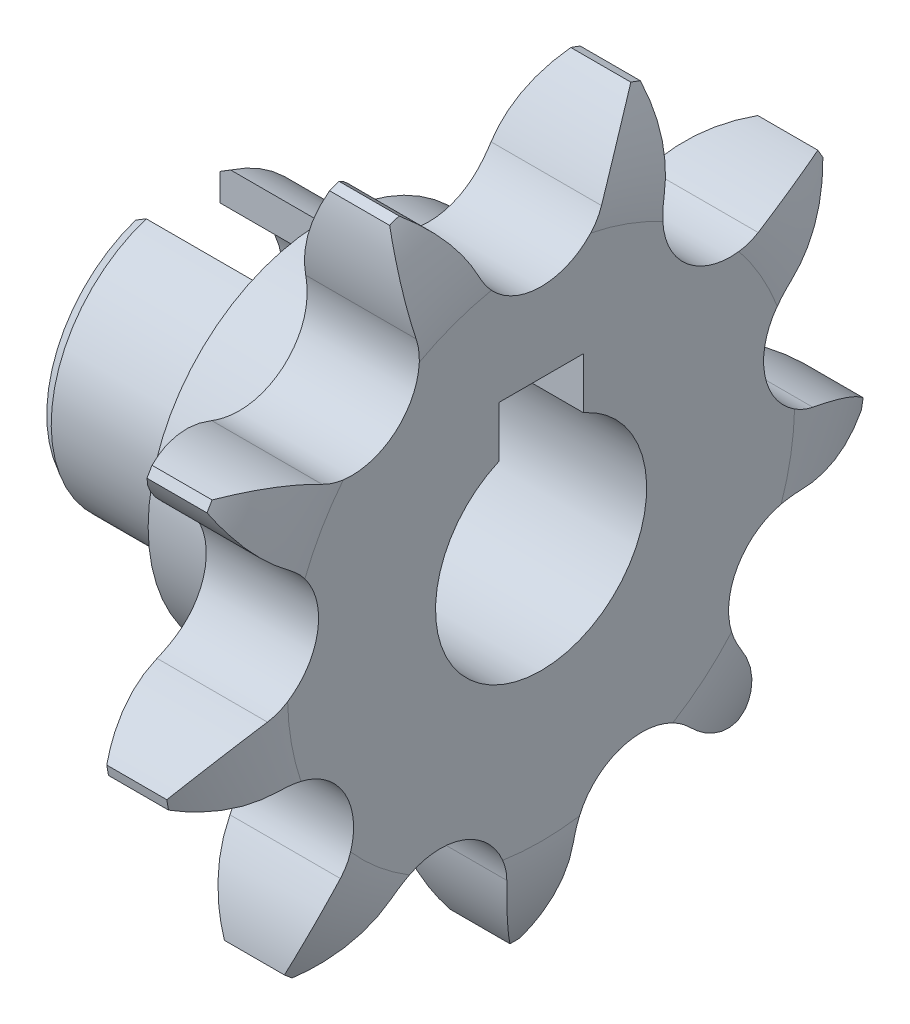
from build123d import *

# Parameters (mm, degrees)
TOOTHCUT_DEPTH     = 25.212835916
TEETHCUTS_COUNT    = 9
TEETHCUTS_ANGLE    = 320
HUBNEAONESKE_R     = 8.409661226
HUBNEARONE_DEPTH   = 16.6809
HUBNEARONEFILLET_R = 0.4
BORSKE_R           = 5
BORE_DEPTH         = 22.0005
SKETCH2_R          = 10
CUT_EXTRUDE2_DEPTH = 4.8
SKETCH1_OUTSIDE_W  = 44.854
SKETCH1_OUTSIDE_H  = 44.354
SKETCH1_OUTSIDE_R  = 6.5
CUT_EXTRUDE1_DEPTH = 7
CHAMFER1_SIZE      = 0.5
CHAMFER1_SIZE2     = 0.288675135
SKETCH3_W          = 4
SKETCH3_H          = 4
CUT_EXTRUDE3_DEPTH = 30.098364443


with BuildPart() as part:
    # BasProSke → Base-Revolve (revolve)
    with BuildSketch(Plane(origin=(0, 0, 0), x_dir=(1, 0, 0), z_dir=(0, 1, 0)), mode=Mode.PRIVATE) as base_revolve_sk:
        with BuildLine():
            Line((0, 0), (0, 12.006866982))
            ThreePointArc((0, 12.006866982), (0.314698702, 14.435029868), (1.238, 16.702743471))
            Line((1.238, 16.702743471), (4.0816, 16.702743471))
            ThreePointArc((4.0816, 16.702743471), (5.004901298, 14.435029868), (5.3196, 12.006866982))
            Line((5.3196, 12.006866982), (5.3196, 0))
            Line((5.3196, 0), (0, 0))
        make_face()
    revolve(base_revolve_sk.sketch.rotate(Axis((-10, 0, 0), (1, 0, 0)), 180), axis=Axis((-10, 0, 0), (1, 0, 0)))

    # TooCutSke → ToothCut (cut, through all)
    with BuildSketch(Plane(origin=(0, 0, 0), x_dir=(0, 0, -1), z_dir=(1, 0, 0))):
        with BuildLine():
            ThreePointArc((2.906302496, 12.60113736), (4.198990076, 14.583034398), (5.994051414, 16.124693193))
            ThreePointArc((5.994051414, 16.124693193), (0, 17.202743471), (-5.994051414, 16.124693193))
            ThreePointArc((-5.994051414, 16.124693193), (-4.198990076, 14.583034398), (-2.906302496, 12.60113736))
            ThreePointArc((-2.906302496, 12.60113736), (0, 10.749618471), (2.906302496, 12.60113736))
        make_face()
    toothcut = extrude(amount=TOOTHCUT_DEPTH, mode=Mode.SUBTRACT)

    # TeethCuts: ToothCut ×9 about axis
    teethcuts_axis = Axis((-10, 0, 0), (1, 0, 0))
    for i in range(1, TEETHCUTS_COUNT):
        add(toothcut.rotate(teethcuts_axis, i * TEETHCUTS_ANGLE / (TEETHCUTS_COUNT - 1)), mode=Mode.SUBTRACT)

    # HubNeaOneSke → HubNearOne (add)
    with BuildSketch(Plane.ZY):
        with Locations(Location((0, 0, 0), (0, 0, 180))):
            Circle(HUBNEAONESKE_R)
    extrude(amount=HUBNEARONE_DEPTH)

    # HubNearOneFillet
    hubnearonefillet_edges = [part.edges().sort_by_distance(p)[0] for p in [
        (0, 0, 8.409661226),
    ]]
    fillet(hubnearonefillet_edges, radius=HUBNEARONEFILLET_R)

    # BorSke → Bore (cut, symmetric)
    with BuildSketch(Plane(origin=(0, 0, 0), x_dir=(0, 0, -1), z_dir=(1, 0, 0))):
        with Locations(Location((0, 0, 0), (0, 0, 180))):
            Circle(BORSKE_R)
    extrude(amount=BORE_DEPTH, both=True, mode=Mode.SUBTRACT)

    # Sketch2 → Cut-Extrude2 (cut)
    with BuildSketch(Plane.ZY.offset(16.6809)):
        Circle(SKETCH2_R)
    extrude(amount=-CUT_EXTRUDE2_DEPTH, mode=Mode.SUBTRACT)

    # Sketch1 outside → Cut-Extrude1 (cut)
    with BuildSketch(Plane.ZY.offset(11.8809)):
        with Locations((0, -0.464)):
            Rectangle(SKETCH1_OUTSIDE_W, SKETCH1_OUTSIDE_H)
        Circle(SKETCH1_OUTSIDE_R, mode=Mode.SUBTRACT)
    extrude(amount=-CUT_EXTRUDE1_DEPTH, mode=Mode.SUBTRACT)

    # Chamfer1
    chamfer1_edges = [part.edges().sort_by_distance(p)[0] for p in [
        (-11.8809, 0, -6.5),
    ]]
    chamfer1_side = [part.faces().sort_by_distance(p)[0] for p in [
        (-8.3809, 0, -6.5),
    ]]
    chamfer(chamfer1_edges, length=CHAMFER1_SIZE, length2=CHAMFER1_SIZE2, reference=chamfer1_side[0])

    # Sketch3 → Cut-Extrude3 (cut, through all)
    with BuildSketch(Plane(origin=(5.3196, 0, 0), x_dir=(0, 0, -1), z_dir=(1, 0, 0))):
        with Locations((0, 5)):
            Rectangle(SKETCH3_W, SKETCH3_H)
    extrude(amount=-CUT_EXTRUDE3_DEPTH, mode=Mode.SUBTRACT)


solid = part.part
